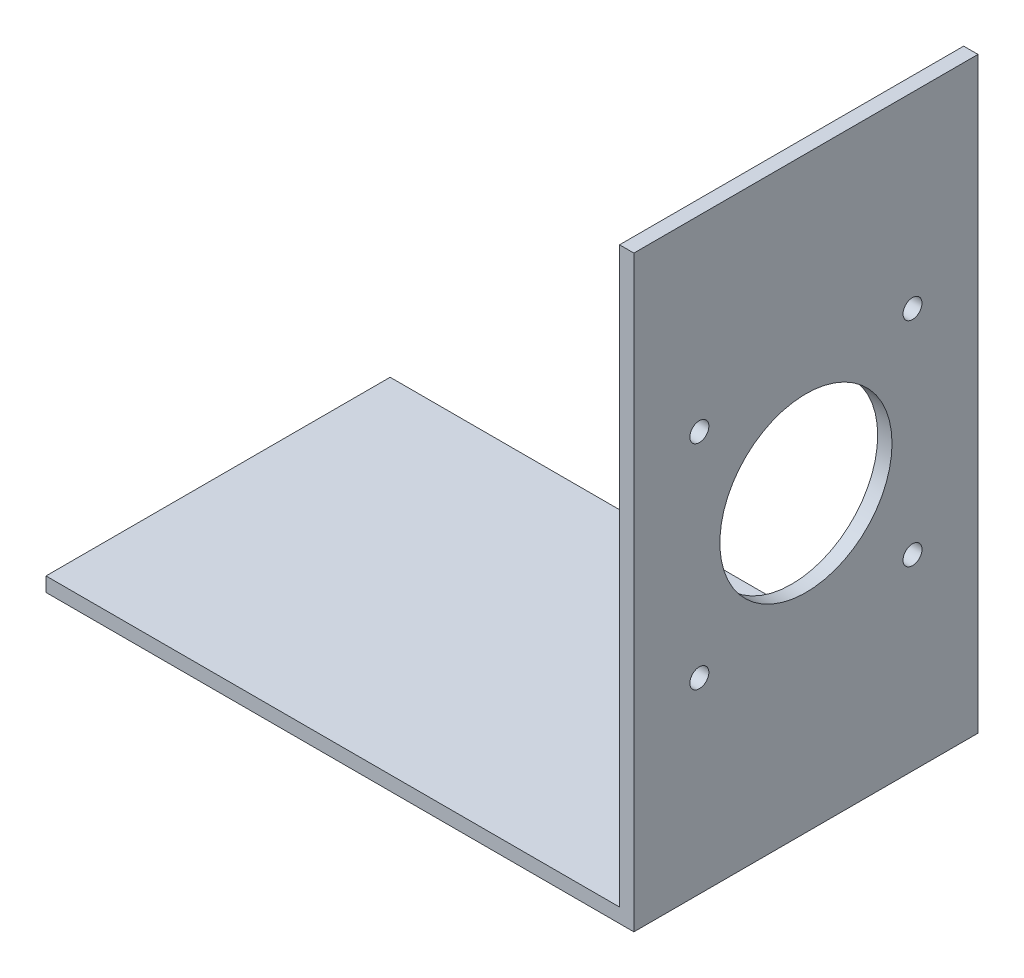
from build123d import *

# Parameters (mm, degrees)
EXTRUDE_THIN1_DEPTH             = 76.2
TAP_DRILL_FOR_M5X0_8_TAP1_D     = 4.2
TAP_DRILL_FOR_M5X0_8_TAP1_DEPTH = 11.938
TAP_DRILL_FOR_M5X0_8_TAP1_TIP   = 1.2618073
SKETCH4_R                       = 19.0627
CUT_EXTRUDE1_DEPTH              = 198.182581951


with BuildPart() as part:
    # Sketch1 → Extrude-Thin1 (new body)
    with BuildSketch(Plane.XY):
        Polygon((0, 0), (127, 0), (127, 127), (130.175, 127), (130.175, -3.175), (0, -3.175), align=None)
    extrude(amount=EXTRUDE_THIN1_DEPTH)

    # Tap Drill for M5x0.8 Tap1
    with Locations(Plane(origin=(130.175, 0, 0), x_dir=(0, 0, -1), z_dir=(1, 0, 0))):
        with Locations((-14.5, 85.5125), (-61.7, 38.3125), (-61.7, 85.5125), (-14.5, 38.3125)):
            Hole(TAP_DRILL_FOR_M5X0_8_TAP1_D / 2, depth=TAP_DRILL_FOR_M5X0_8_TAP1_DEPTH)
            with Locations((0, 0, -(TAP_DRILL_FOR_M5X0_8_TAP1_DEPTH + TAP_DRILL_FOR_M5X0_8_TAP1_TIP / 2))):  # 118° drill point
                Cone(0, TAP_DRILL_FOR_M5X0_8_TAP1_D / 2, TAP_DRILL_FOR_M5X0_8_TAP1_TIP, mode=Mode.SUBTRACT)

    # Sketch4 → Cut-Extrude1 (cut, through all)
    with BuildSketch(Plane(origin=(130.175, 0, 0), x_dir=(0, 0, -1), z_dir=(1, 0, 0))):
        with Locations((-38.1, 61.9125)):
            Circle(SKETCH4_R)
    extrude(amount=-CUT_EXTRUDE1_DEPTH, mode=Mode.SUBTRACT)


solid = part.part
